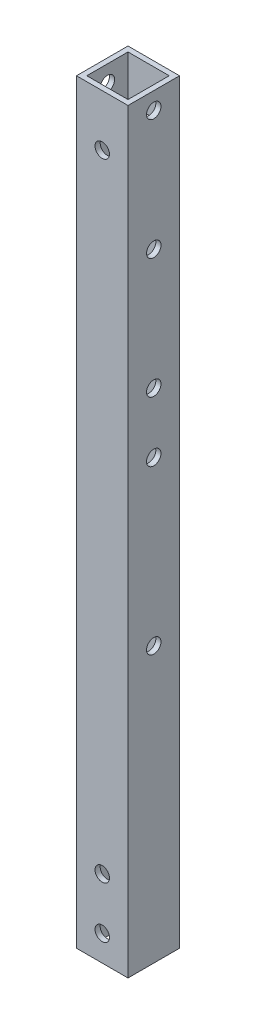
from build123d import *

# Parameters (mm, degrees)
SKETCH_1_W          = 15
SKETCH_1_H          = 15
SKETCH_1_W_2        = 12
SKETCH_1_H_2        = 12
EXTRUDE_1_DEPTH     = 220
SKETCH_2_R          = 2.1
CUT_EXTRUDE_1_DEPTH = 221.638278637
SKETCH_3_R          = 2.1
CUT_EXTRUDE_2_DEPTH = 221.638278637
SKETCH_4_R          = 2.1
CUT_EXTRUDE_3_DEPTH = 221.638278637
SKETCH_5_R          = 2.1
CUT_EXTRUDE_4_DEPTH = 221.638278637
SKETCH_6_R          = 2.1
CUT_EXTRUDE_5_DEPTH = 221.638278637


with BuildPart() as part:
    # ｽｹｯﾁ1 → 押し出し-薄板1 (new body)
    with BuildSketch(Plane(origin=(0, 0, 0), x_dir=(1, 0, 0), z_dir=(0, 1, 0))):
        Rectangle(SKETCH_1_W, SKETCH_1_H)
        Rectangle(SKETCH_1_W_2, SKETCH_1_H_2, mode=Mode.SUBTRACT)
    extrude(amount=EXTRUDE_1_DEPTH)

    # ｽｹｯﾁ2 → ｶｯﾄ - 押し出し1 (cut, through all)
    with BuildSketch(Plane(origin=(7.5, 0, 0), x_dir=(0, 0, -1), z_dir=(1, 0, 0))):
        with Locations((0, 215)):
            Circle(SKETCH_2_R)
    extrude(amount=-CUT_EXTRUDE_1_DEPTH, mode=Mode.SUBTRACT)

    # ｽｹｯﾁ3 → ｶｯﾄ - 押し出し2 (cut, through all)
    with BuildSketch(Plane(origin=(7.5, 0, 0), x_dir=(0, 0, -1), z_dir=(1, 0, 0))):
        with Locations((0, 145)):
            Circle(SKETCH_3_R)
        with Locations((0, 180)):
            Circle(SKETCH_3_R)
    extrude(amount=-CUT_EXTRUDE_2_DEPTH, mode=Mode.SUBTRACT)

    # ｽｹｯﾁ4 → ｶｯﾄ - 押し出し3 (cut, through all)
    with BuildSketch(Plane.XY.offset(7.5)):
        with Locations((0, 205)):
            Circle(SKETCH_4_R)
    extrude(amount=-CUT_EXTRUDE_3_DEPTH, mode=Mode.SUBTRACT)

    # ｽｹｯﾁ5 → ｶｯﾄ - 押し出し4 (cut, through all)
    with BuildSketch(Plane.XY.offset(7.5)):
        with Locations((0, 22.5)):
            Circle(SKETCH_5_R)
        with Locations((0, 7.5)):
            Circle(SKETCH_5_R)
    extrude(amount=-CUT_EXTRUDE_4_DEPTH, mode=Mode.SUBTRACT)

    # ｽｹｯﾁ6 → ｶｯﾄ - 押し出し5 (cut, through all)
    with BuildSketch(Plane(origin=(7.5, 0, 0), x_dir=(0, 0, -1), z_dir=(1, 0, 0))):
        with Locations((0, 80)):
            Circle(SKETCH_6_R)
        with Locations((0, 127.5)):
            Circle(SKETCH_6_R)
    extrude(amount=-CUT_EXTRUDE_5_DEPTH, mode=Mode.SUBTRACT)


solid = part.part
